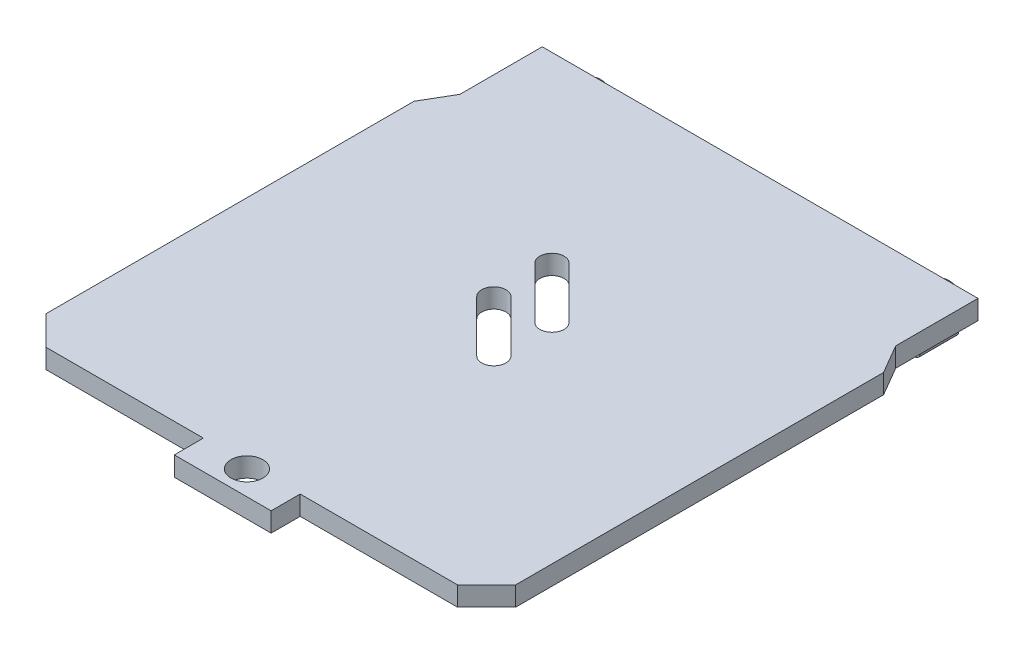
from build123d import *

# Parameters (mm, degrees)
EXTRUDE_START        = 90
SKETCH_1_R           = 1.65
EXTRUDE_262_DEPTH    = 2
EXTRUDE_START_2      = 4
EXTRUDE_1_DEPTH      = 4
D3P2_1_START         = 2
SKETCH_3_R           = 1.6
D3P2_1_DEPTH         = 2
EXTRUDE_1_2_DEPTH    = 4
SKETCH_5_R           = 1.6
D3P2_1_2_DEPTH       = 2
CUT_EXTRUDE_START    = 90
CUT_EXTRUDE_45_DEPTH = 2


with BuildPart() as part:
    # 草图1 → Extrude 262 (new body)
    with BuildSketch(Plane(origin=(0, 0, 0), x_dir=(1, 0, 0), z_dir=(0, 1, 0)).offset(EXTRUDE_START)):
        Polygon((-22.5, -3.5), (-22.5, -12), (-24.25, -15), (-24.25, -53), (-21.25, -56), (-5, -56), (-5, -59), (5, -59), (5, -56), (21.25, -56), (24.25, -53), (24.25, -15), (22.5, -12), (22.5, -3.5), align=None)
        with Locations(Location((0, -56.5, 0), (0, 0, 270))):
            Circle(SKETCH_1_R, mode=Mode.SUBTRACT)
    extrude(amount=EXTRUDE_262_DEPTH)

    # 草图2 → Extrude 1 (add)
    with BuildSketch(Plane.XY.offset(EXTRUDE_START_2)):
        with BuildLine():
            Line((-20.5, 88), (-15.5, 88))
            ThreePointArc((-15.5, 88), (-15.146446609, 88.146446609), (-15, 88.5))
            Line((-15, 88.5), (-15, 89.5))
            ThreePointArc((-15, 89.5), (-15.146446609, 89.853553391), (-15.5, 90))
            Line((-15.5, 90), (-20.5, 90))
            ThreePointArc((-20.5, 90), (-20.853553391, 89.853553391), (-21, 89.5))
            Line((-21, 89.5), (-21, 88.5))
            ThreePointArc((-21, 88.5), (-20.853553391, 88.146446609), (-20.5, 88))
        make_face()
    extrude(amount=EXTRUDE_1_DEPTH)

    # 草图3 → D3p2_-1 (add)
    with BuildSketch(Plane.XY.offset(D3P2_1_START)):
        with Locations(Location((-18, 89, 0), (0, 0, 218.682187453))):
            Circle(SKETCH_3_R)
    extrude(amount=D3P2_1_DEPTH)

    # 草图4 → Extrude 1 2 (add)
    with BuildSketch(Plane.XY.offset(EXTRUDE_START_2)):
        with BuildLine():
            Line((15.5, 88), (20.5, 88))
            ThreePointArc((20.5, 88), (20.853553391, 88.146446609), (21, 88.5))
            Line((21, 88.5), (21, 89.5))
            ThreePointArc((21, 89.5), (20.853553391, 89.853553391), (20.5, 90))
            Line((20.5, 90), (15.5, 90))
            ThreePointArc((15.5, 90), (15.146446609, 89.853553391), (15, 89.5))
            Line((15, 89.5), (15, 88.5))
            ThreePointArc((15, 88.5), (15.146446609, 88.146446609), (15.5, 88))
        make_face()
    extrude(amount=EXTRUDE_1_2_DEPTH)

    # 草图5 → D3p2_1 2 (add)
    with BuildSketch(Plane.XY.offset(D3P2_1_START)):
        with Locations(Location((18, 89, 0), (0, 0, 218.682187453))):
            Circle(SKETCH_5_R)
    extrude(amount=D3P2_1_2_DEPTH)

    # 草图6 → 后盖45度平行通气孔 (cut)
    with BuildSketch(Plane(origin=(0, 0, 0), x_dir=(1, 0, 0), z_dir=(0, 1, 0)).offset(CUT_EXTRUDE_START)):
        with BuildLine():
            Line((-1.767766953, -21.464466094), (3.535533906, -26.767766953))
            ThreePointArc((3.535533906, -26.767766953), (3.535533906, -28.535533906), (1.767766953, -28.535533906))
            Line((1.767766953, -28.535533906), (-3.535533906, -23.232233047))
            ThreePointArc((-3.535533906, -23.232233047), (-3.535533906, -21.464466094), (-1.767766953, -21.464466094))
        make_face()
        with BuildLine():
            Line((-1.767766953, -27.464466094), (3.535533906, -32.767766953))
            ThreePointArc((3.535533906, -32.767766953), (3.535533906, -34.535533906), (1.767766953, -34.535533906))
            Line((1.767766953, -34.535533906), (-3.535533906, -29.232233047))
            ThreePointArc((-3.535533906, -29.232233047), (-3.535533906, -27.464466094), (-1.767766953, -27.464466094))
        make_face()
    extrude(amount=CUT_EXTRUDE_45_DEPTH, mode=Mode.SUBTRACT)


solid = part.part
